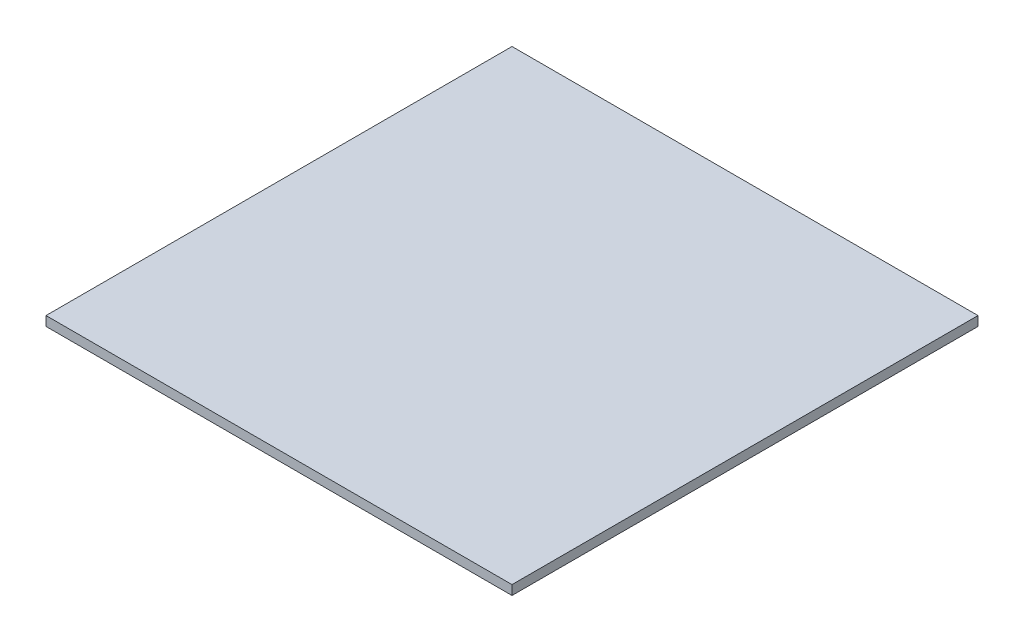
from build123d import *

# Parameters (mm, degrees)
SKETCH1_W           = 10
SKETCH1_H           = 10
BOSS_EXTRUDE1_DEPTH = 0.203


with BuildPart() as part:
    # Sketch1 → Boss-Extrude1 (new body)
    with BuildSketch(Plane(origin=(0, 0, 0), x_dir=(1, 0, 0), z_dir=(0, 1, 0))):
        Rectangle(SKETCH1_W, SKETCH1_H)
    extrude(amount=BOSS_EXTRUDE1_DEPTH)


solid = part.part
